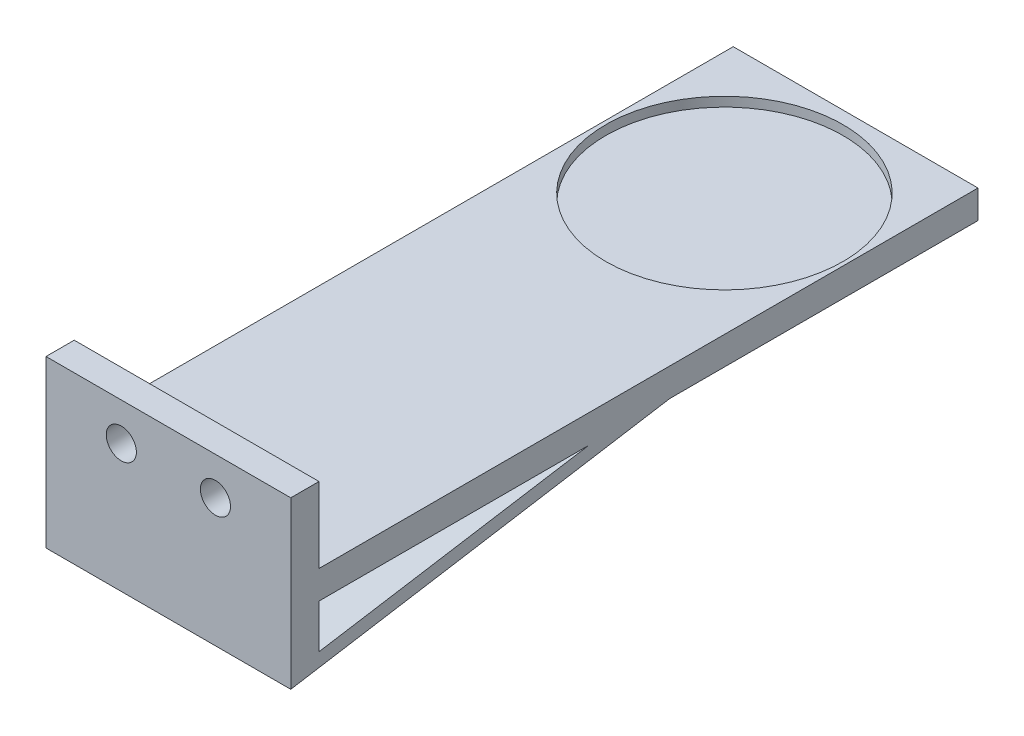
from build123d import *

# Parameters (mm, degrees)
EXTRUDE_1_DEPTH     = 26
SKETCH_2_R          = 1.6
CUT_EXTRUDE_1_DEPTH = 10
SKETCH_3_R          = 12.6
CUT_EXTRUDE_2_DEPTH = 1


with BuildPart() as part:
    # 草图1 → 凸台-拉伸1 (new body)
    with BuildSketch(Plane(origin=(0, 0, 0), x_dir=(0, 0, -1), z_dir=(1, 0, 0))):
        Polygon((-36.5, -8.11923054), (3.755241517, -1.5), (36.5, -1.5), (36.5, 1.5), (-33.5, 1.5), (-33.5, 9.5), (-36.5, 9.5), align=None)
        Polygon((-4.861119654, -1.5), (-33.5, -6.160415563), (-33.5, -1.5), align=None, mode=Mode.SUBTRACT)
    extrude(amount=EXTRUDE_1_DEPTH)

    # 草图2 → 切除-拉伸1 (cut)
    with BuildSketch(Plane.XY.offset(36.5)):
        with Locations((8, 5.5)):
            Circle(SKETCH_2_R)
        with Locations((18, 5.5)):
            Circle(SKETCH_2_R)
    extrude(amount=-CUT_EXTRUDE_1_DEPTH, mode=Mode.SUBTRACT)

    # 草图3 → 切除-拉伸2 (cut)
    with BuildSketch(Plane(origin=(0, 1.5, 0), x_dir=(1, 0, 0), z_dir=(0, 1, 0))):
        with Locations(Location((13, 22.563165018, 0), (0, 0, 270))):
            Circle(SKETCH_3_R)
    extrude(amount=-CUT_EXTRUDE_2_DEPTH, mode=Mode.SUBTRACT)


solid = part.part
